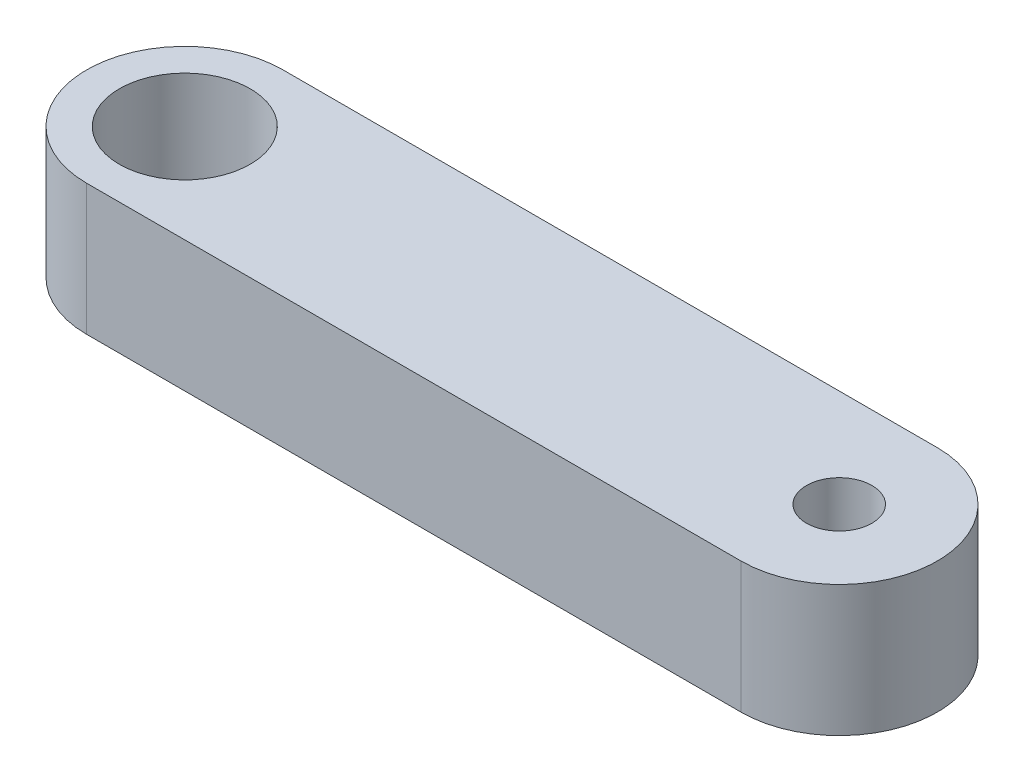
from build123d import *

# Parameters (mm, degrees)
SKETCH1_R           = 2.5
SKETCH1_R_2         = 5
BOSS_EXTRUDE1_DEPTH = 10


with BuildPart() as part:
    # Sketch1 → Boss-Extrude1 (new body)
    with BuildSketch(Plane(origin=(0, 0, 0), x_dir=(1, 0, 0), z_dir=(0, 1, 0))):
        with BuildLine():
            Line((0, 0), (50, 0))
            ThreePointArc((50, 0), (57.5, 7.5), (50, 15))
            Line((50, 15), (0, 15))
            ThreePointArc((0, 15), (-7.5, 7.5), (0, 0))
        make_face()
        with Locations(Location((50, 7.5, 0), (0, 0, 270))):
            Circle(SKETCH1_R, mode=Mode.SUBTRACT)
        with Locations(Location((0, 7.5, 0), (0, 0, 270))):
            Circle(SKETCH1_R_2, mode=Mode.SUBTRACT)
    extrude(amount=BOSS_EXTRUDE1_DEPTH)


solid = part.part
